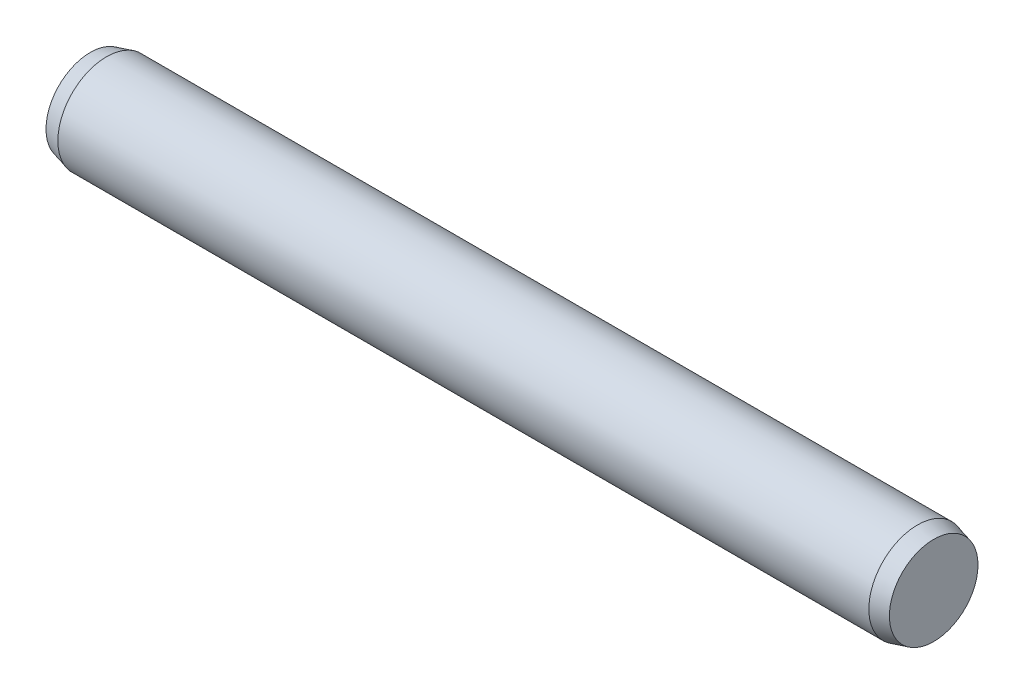
from build123d import *

# Parameters (mm, degrees)
EXTRUDE1_DEPTH      = 12.5
EXTRUDE1_DEPTH_BACK = 12.5
SKETCH2_R           = 1.5
SKETCH3_R           = 1.5
EXTRUDE2_DEPTH      = 0.5
EXTRUDE2_TAPER      = 15
SKETCH4_R           = 1.5
EXTRUDE3_DEPTH      = 0.5
EXTRUDE3_TAPER      = 15


with BuildPart() as part:
    # Sketch2 → Extrude1 (new, two sides: drawn at the far end of the back side and taken through both)
    with BuildSketch(Plane(origin=(0, 0, 0), x_dir=(0, 0, -1), z_dir=(1, 0, 0)).offset(-EXTRUDE1_DEPTH_BACK)):
        Circle(SKETCH2_R)
    extrude(amount=EXTRUDE1_DEPTH + EXTRUDE1_DEPTH_BACK)

    # Sketch3 → Extrude2 (add)
    with BuildSketch(Plane(origin=(12.5, 0, 0), x_dir=(0, 0, -1), z_dir=(1, 0, 0))):
        Circle(SKETCH3_R)
    extrude(amount=EXTRUDE2_DEPTH, taper=EXTRUDE2_TAPER)

    # Sketch4 → Extrude3 (add)
    with BuildSketch(Plane.ZY.offset(12.5)):
        with Locations(Location((0, 0, 0), (0, 0, 180))):
            Circle(SKETCH4_R)
    extrude(amount=EXTRUDE3_DEPTH, taper=EXTRUDE3_TAPER)


solid = part.part
